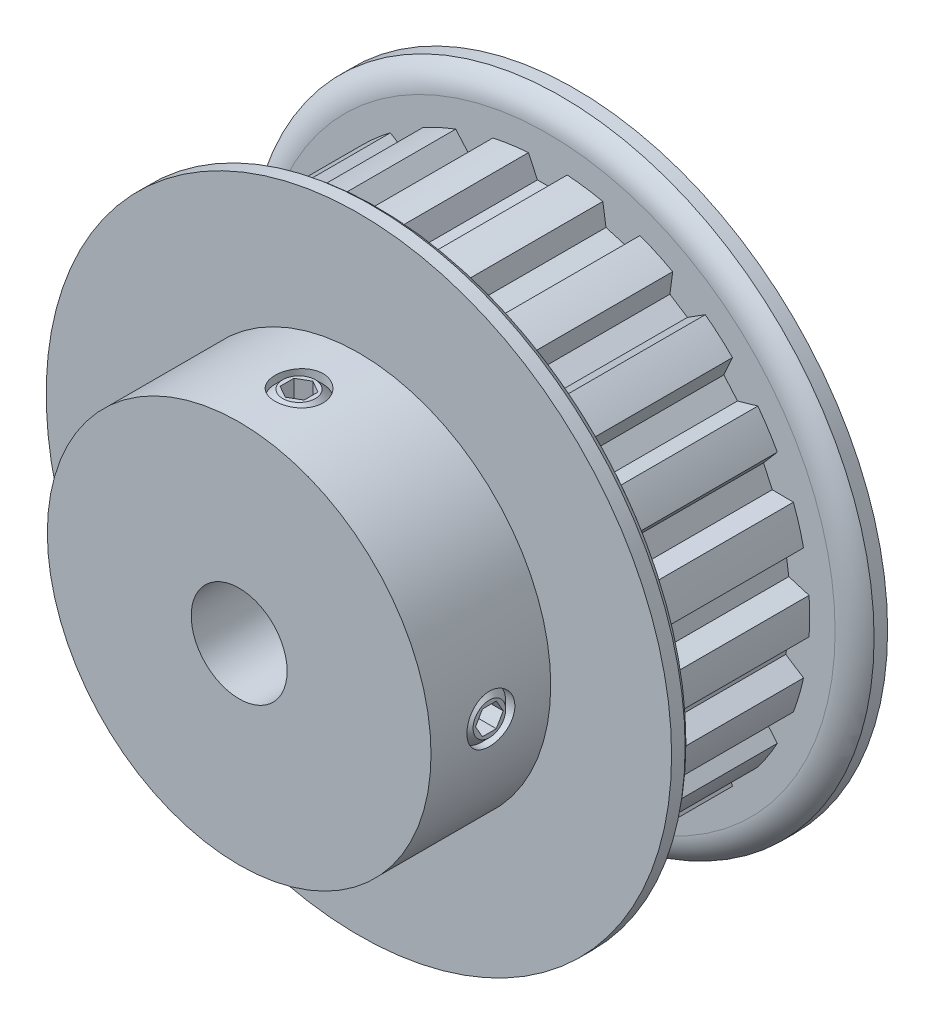
from build123d import *

# Parameters (mm, degrees)
CUT_EXTRUDE1_START = 1.397
CUT_EXTRUDE1_DEPTH = 10.7188
CIRPATTERN1_COUNT  = 22
SKETCH4_R          = 1.5875
CUT_EXTRUDE2_DEPTH = 32.313742323
CUT_EXTRUDE3_DEPTH = 1.190625
CIRPATTERN2_COUNT  = 2
CIRPATTERN2_ANGLE  = 90


with BuildPart() as part:
    # Sketch2 → Revolve1 (revolve)
    with BuildSketch(Plane(origin=(0, 0, 0), x_dir=(0, 0, -1), z_dir=(1, 0, 0)), mode=Mode.PRIVATE) as revolve1_sk:
        with BuildLine():
            Line((-11.1125, 3.175), (11.1125, 3.175))
            Line((11.1125, 3.175), (11.1125, 20.701))
            Line((11.1125, 20.701), (10.21715, 20.701))
            ThreePointArc((10.21715, 20.701), (9.559545279, 19.970397341), (9.3218, 19.016614663))
            Line((9.3218, 19.016614663), (9.3218, 17.332229325))
            Line((9.3218, 17.332229325), (-1.397, 17.332229325))
            Line((-1.397, 17.332229325), (-1.397, 19.016614663))
            ThreePointArc((-1.397, 19.016614663), (-1.634745279, 19.970397341), (-2.29235, 20.701))
            Line((-2.29235, 20.701), (-3.1877, 20.701))
            Line((-3.1877, 20.701), (-3.1877, 12.7))
            Line((-3.1877, 12.7), (-11.1125, 12.7))
            Line((-11.1125, 12.7), (-11.1125, 3.175))
        make_face()
    revolve(revolve1_sk.sketch.rotate(Axis((0, 0, 11.1125), (0, 0, -1)), 90), axis=Axis((0, 0, 11.1125), (0, 0, -1)))

    # Sketch3 → Cut-Extrude1 (cut)
    with BuildSketch(Plane.XY.offset(CUT_EXTRUDE1_START)):
        with BuildLine():
            Line((-0.690489274, 16.0147), (0.690489274, 16.0147))
            Line((0.690489274, 16.0147), (1.2827, 17.2847))
            ThreePointArc((1.2827, 17.2847), (0, 17.332229325), (-1.2827, 17.2847))
            Line((-1.2827, 17.2847), (-0.690489274, 16.0147))
        make_face()
    cut_extrude1 = extrude(amount=-CUT_EXTRUDE1_DEPTH, mode=Mode.SUBTRACT)

    # CirPattern1: Cut-Extrude1 ×22 about axis
    cirpattern1_axis = Axis((0, 0, 0), (0, 0, 1))
    for i in range(1, CIRPATTERN1_COUNT):
        add(cut_extrude1.rotate(cirpattern1_axis, i * 360 / CIRPATTERN1_COUNT), mode=Mode.SUBTRACT)

    # Sketch4 → Cut-Extrude2 (cut, through all)
    with BuildSketch(Plane(origin=(0, 0, 0), x_dir=(1, 0, 0), z_dir=(0, 1, 0))):
        with Locations(Location((0, -7.1501, 0), (0, 0, 90))):
            Circle(SKETCH4_R)
    cut_extrude2 = extrude(amount=CUT_EXTRUDE2_DEPTH, mode=Mode.SUBTRACT)

    # Sketch5 → Revolve2 (revolve)
    with BuildSketch(Plane.XY.offset(7.1501), mode=Mode.PRIVATE) as revolve2_sk:
        Polygon((1.0795, 12.600390619), (1.5875, 12.092390619), (1.5875, 3.81), (0.9525, 3.175), (0, 3.175), (0, 12.600390619), align=None)
    revolve2 = revolve(revolve2_sk.sketch.rotate(Axis((0, 0, 7.1501), (0, 1, 0)), 90), axis=Axis((0, 0, 7.1501), (0, 1, 0)))

    # Sketch6 → Cut-Extrude3 (cut)
    with BuildSketch(Plane(origin=(0, 12.600390619, 0), x_dir=(1, 0, 0), z_dir=(0, 1, 0))):
        Polygon((0, -6.233556448), (-0.79375, -6.691828224), (-0.79375, -7.608371776), (0, -8.066643552), (0.79375, -7.608371776), (0.79375, -6.691828224), align=None)
    cut_extrude3 = extrude(amount=-CUT_EXTRUDE3_DEPTH, mode=Mode.SUBTRACT)

    # CirPattern2: Cut-Extrude2, Revolve2, Cut-Extrude3 ×2 about axis
    cirpattern2_axis = Axis((0, 0, 0), (0, 0, -1))
    add([cut_extrude2.rotate(cirpattern2_axis, i * CIRPATTERN2_ANGLE / (CIRPATTERN2_COUNT - 1)) for i in range(1, CIRPATTERN2_COUNT)], mode=Mode.SUBTRACT)
    add([revolve2.rotate(cirpattern2_axis, i * CIRPATTERN2_ANGLE / (CIRPATTERN2_COUNT - 1)) for i in range(1, CIRPATTERN2_COUNT)])
    add([cut_extrude3.rotate(cirpattern2_axis, i * CIRPATTERN2_ANGLE / (CIRPATTERN2_COUNT - 1)) for i in range(1, CIRPATTERN2_COUNT)], mode=Mode.SUBTRACT)


solid = part.part
